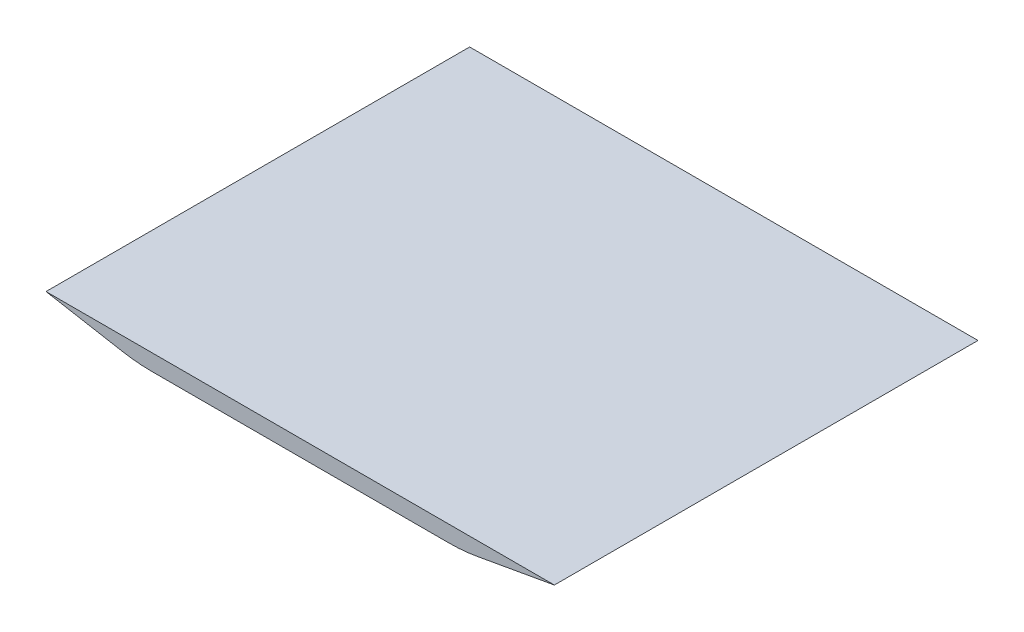
from build123d import *

# Parameters (mm, degrees)
BOSS_EXTRUDE1_DEPTH = 130
FILLET1_R           = 50


with BuildPart() as part:
    # Sketch1 → Boss-Extrude1 (new body)
    with BuildSketch(Plane.XY):
        Polygon((0, 0), (156, 0), (128, -5), (28, -5), align=None)
    extrude(amount=BOSS_EXTRUDE1_DEPTH)

    # Fillet1
    fillet1_edges = [part.edges().sort_by_distance(p)[0] for p in [
        (128, -5, 65),
        (28, -5, 65),
    ]]
    fillet(fillet1_edges, radius=FILLET1_R)


solid = part.part
